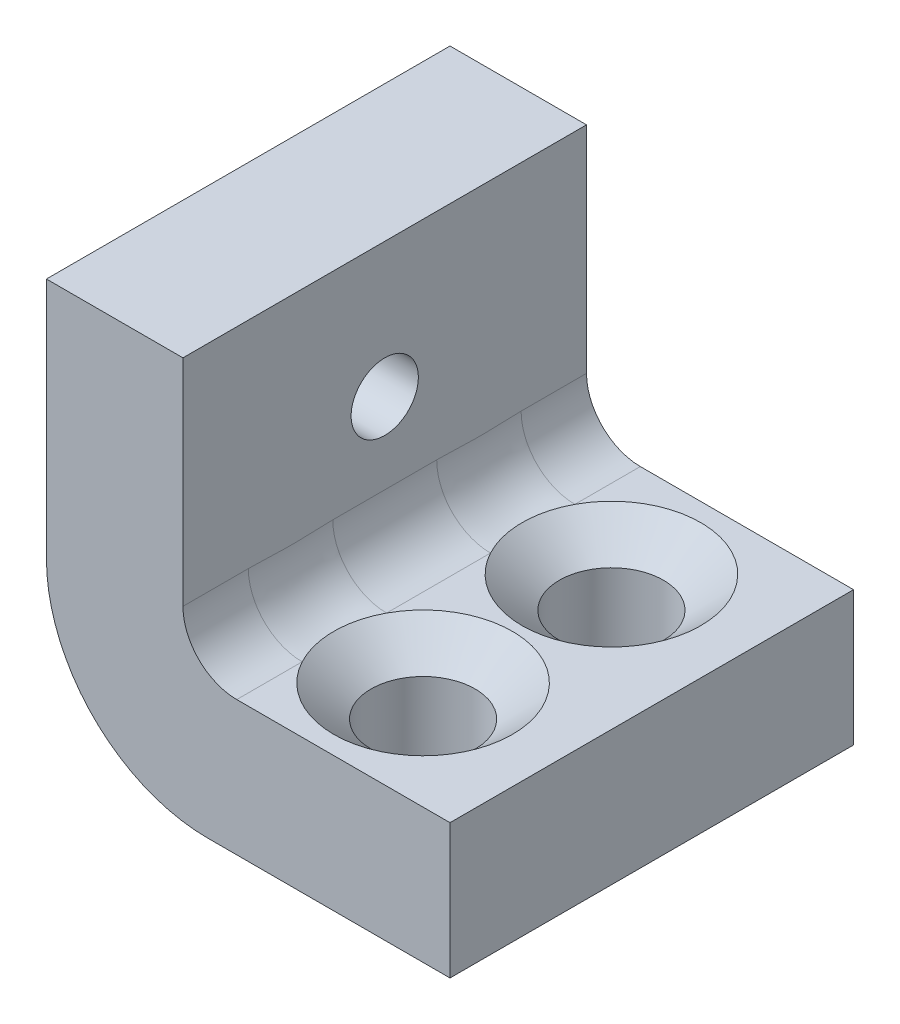
from build123d import *

# Parameters (mm, degrees)
SKETCH1_W                                         = 19.05
SKETCH1_H                                         = 19.05
BOSS_EXTRUDE1_DEPTH                               = 6.35
SKETCH2_W                                         = 6.444113488
SKETCH2_H                                         = 19.05
BOSS_EXTRUDE2_DEPTH                               = 12.7
CSK_FOR_8_FLAT_HEAD_MACHINE_SCREW_100_D           = 4.9149
CSK_FOR_8_FLAT_HEAD_MACHINE_SCREW_100_DEPTH       = 23.368
CSK_FOR_8_FLAT_HEAD_MACHINE_SCREW_100_CSINK_D     = 8.4328
CSK_FOR_8_FLAT_HEAD_MACHINE_SCREW_100_CSINK_ANGLE = 100
CSK_FOR_8_FLAT_HEAD_MACHINE_SCREW_100_TIP         = 1.476584928
SKETCH5_R                                         = 1.5875
CUT_EXTRUDE1_DEPTH                                = 12.7
FILLET1_R                                         = 2.54
FILLET2_R                                         = 7.62


with BuildPart() as part:
    # Sketch1 → Boss-Extrude1 (new body)
    with BuildSketch(Plane(origin=(0, 0, 0), x_dir=(1, 0, 0), z_dir=(0, 1, 0))):
        with Locations((9.525, 9.525)):
            Rectangle(SKETCH1_W, SKETCH1_H)
    extrude(amount=BOSS_EXTRUDE1_DEPTH)

    # Sketch2 → Boss-Extrude2 (add)
    with BuildSketch(Plane(origin=(0, 6.35, 0), x_dir=(1, 0, 0), z_dir=(0, 1, 0))):
        with Locations((3.222056744, 9.525)):
            Rectangle(SKETCH2_W, SKETCH2_H)
    extrude(amount=BOSS_EXTRUDE2_DEPTH)

    # CSK for #8 Flat Head Machine Screw (100)1
    with Locations(Plane(origin=(0, 6.35, 0), x_dir=(1, 0, 0), z_dir=(0, 1, 0))):
        with Locations((12.7, 13.97), (12.7, 5.08)):
            CounterSinkHole(CSK_FOR_8_FLAT_HEAD_MACHINE_SCREW_100_D / 2, CSK_FOR_8_FLAT_HEAD_MACHINE_SCREW_100_CSINK_D / 2, depth=CSK_FOR_8_FLAT_HEAD_MACHINE_SCREW_100_DEPTH, counter_sink_angle=CSK_FOR_8_FLAT_HEAD_MACHINE_SCREW_100_CSINK_ANGLE)
            with Locations((0, 0, -(CSK_FOR_8_FLAT_HEAD_MACHINE_SCREW_100_DEPTH + CSK_FOR_8_FLAT_HEAD_MACHINE_SCREW_100_TIP / 2))):  # 118° drill point
                Cone(0, CSK_FOR_8_FLAT_HEAD_MACHINE_SCREW_100_D / 2, CSK_FOR_8_FLAT_HEAD_MACHINE_SCREW_100_TIP, mode=Mode.SUBTRACT)

    # Sketch5 → Cut-Extrude1 (cut)
    with BuildSketch(Plane(origin=(6.444113488, 0, 0), x_dir=(0, 0, -1), z_dir=(1, 0, 0))):
        with Locations((9.525, 12.7)):
            Circle(SKETCH5_R)
    extrude(amount=-CUT_EXTRUDE1_DEPTH, mode=Mode.SUBTRACT)

    # Fillet1
    fillet1_edges = [part.edges().sort_by_distance(p)[0] for p in [
        (6.444113488, 6.35, -9.525),
    ]]
    fillet(fillet1_edges, radius=FILLET1_R)

    # Fillet2
    fillet2_edges = [part.edges().sort_by_distance(p)[0] for p in [
        (0, 0, -9.525),
    ]]
    fillet(fillet2_edges, radius=FILLET2_R)


solid = part.part
